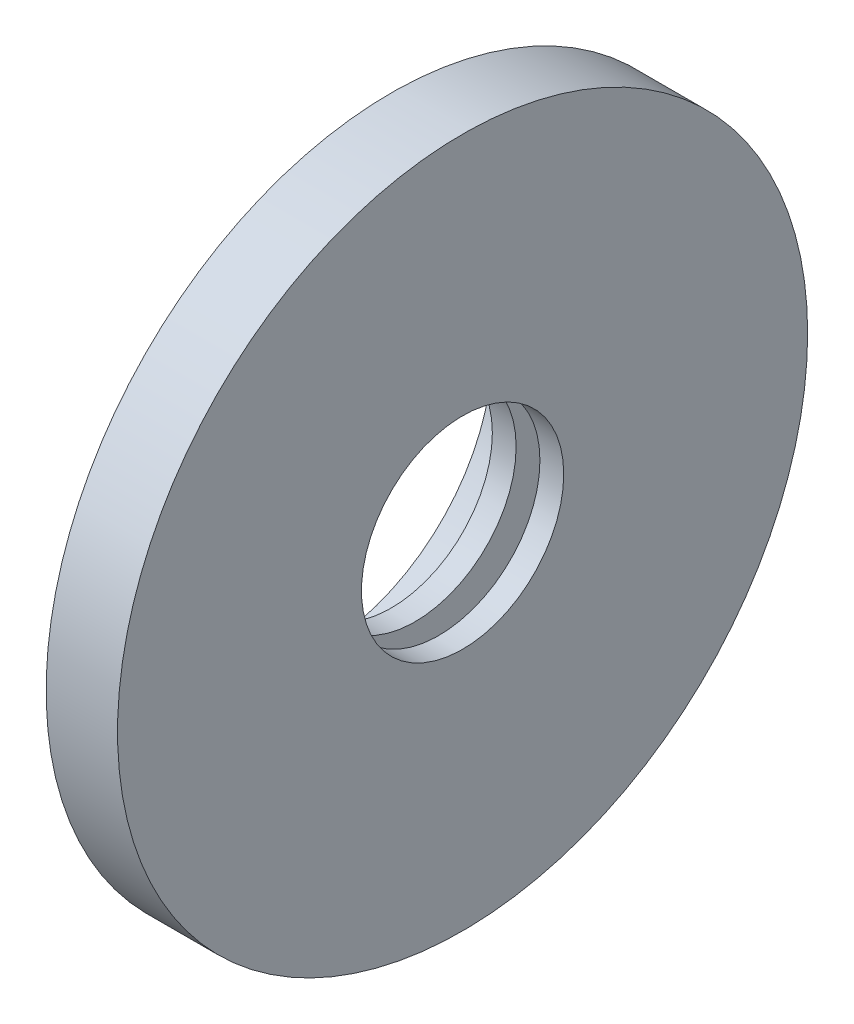
from build123d import *


with BuildPart() as part:
    # 草图1 → 旋转1 (revolve)
    with BuildSketch(Plane.XY, mode=Mode.PRIVATE) as revolve_1_sk:
        Polygon((0, 0), (0, 14.5), (-6, 14.5), (-6, 18.5), (0, 18.5), (0, 29), (6, 29), (6, 0), align=None)
    revolve(revolve_1_sk.sketch.rotate(Axis((0, 0, 0), (-1, 0, 0)), 90), axis=Axis((0, 0, 0), (-1, 0, 0)))

    # 草图2 → 切除-旋转1 (revolve, cut)
    with BuildSketch(Plane.XY, mode=Mode.PRIVATE) as cut_revolve_1_sk:
        Polygon((0, 0), (0, 8.5), (2, 8.5), (2, 12.5), (4, 12.5), (4, 8.5), (6, 8.5), (6, 0), align=None)
    revolve(cut_revolve_1_sk.sketch.rotate(Axis((0, 0, 0), (-1, 0, 0)), 90), axis=Axis((0, 0, 0), (-1, 0, 0)), mode=Mode.SUBTRACT)


solid = part.part
